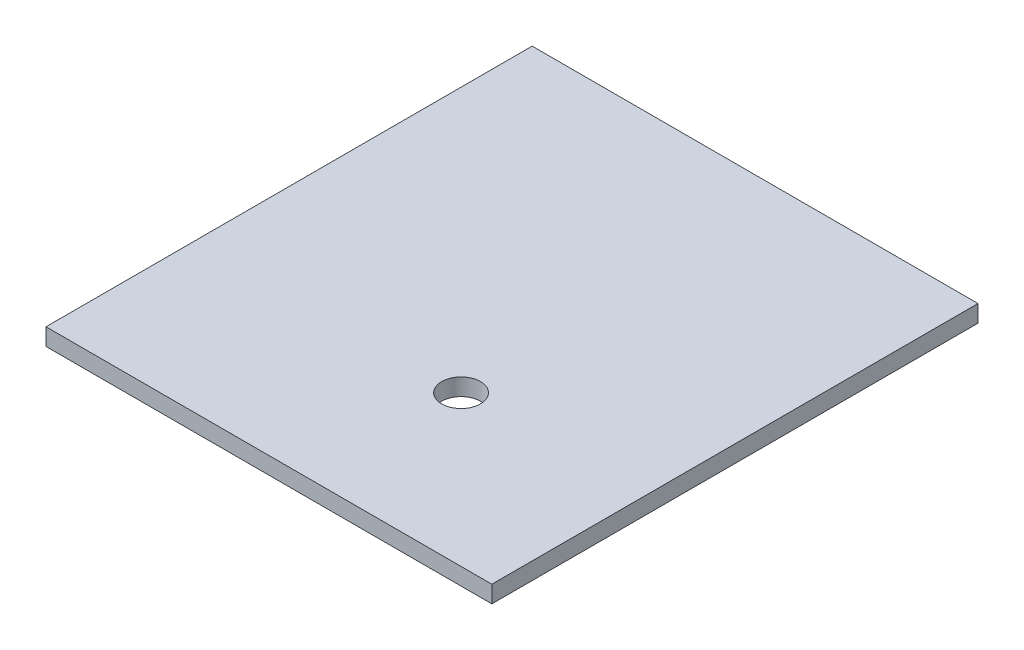
from build123d import *

# Parameters (mm, degrees)
SKETCH1_W           = 146.05
SKETCH1_H           = 159.258
BOSS_EXTRUDE1_DEPTH = 5.588
CUT_EXTRUDE1_REACH  = 110.188
SKETCH4_R           = 6.35


with BuildPart() as part:
    # Sketch1 → Boss-Extrude1 (new body)
    with BuildSketch(Plane(origin=(0, 0, 0), x_dir=(1, 0, 0), z_dir=(0, 1, 0))):
        Rectangle(SKETCH1_W, SKETCH1_H)
    extrude(amount=BOSS_EXTRUDE1_DEPTH)

    # Sketch4 → Cut-Extrude1 (cut, up to next)
    with BuildSketch(Plane(origin=(0, 5.588, 0), x_dir=(1, 0, 0), z_dir=(0, 1, 0)), mode=Mode.PRIVATE) as cut_extrude1_sk1:
        with Locations(Location((13.670647071, -30.353, 0), (0, 0, 270))):
            Circle(SKETCH4_R)
    cut_extrude1_tool1 = extrude(cut_extrude1_sk1.sketch, amount=-CUT_EXTRUDE1_REACH, mode=Mode.PRIVATE) & part.part
    add(cut_extrude1_tool1.solids().sort_by_distance((13.670647, 5.588, 30.353))[0], mode=Mode.SUBTRACT)


solid = part.part
